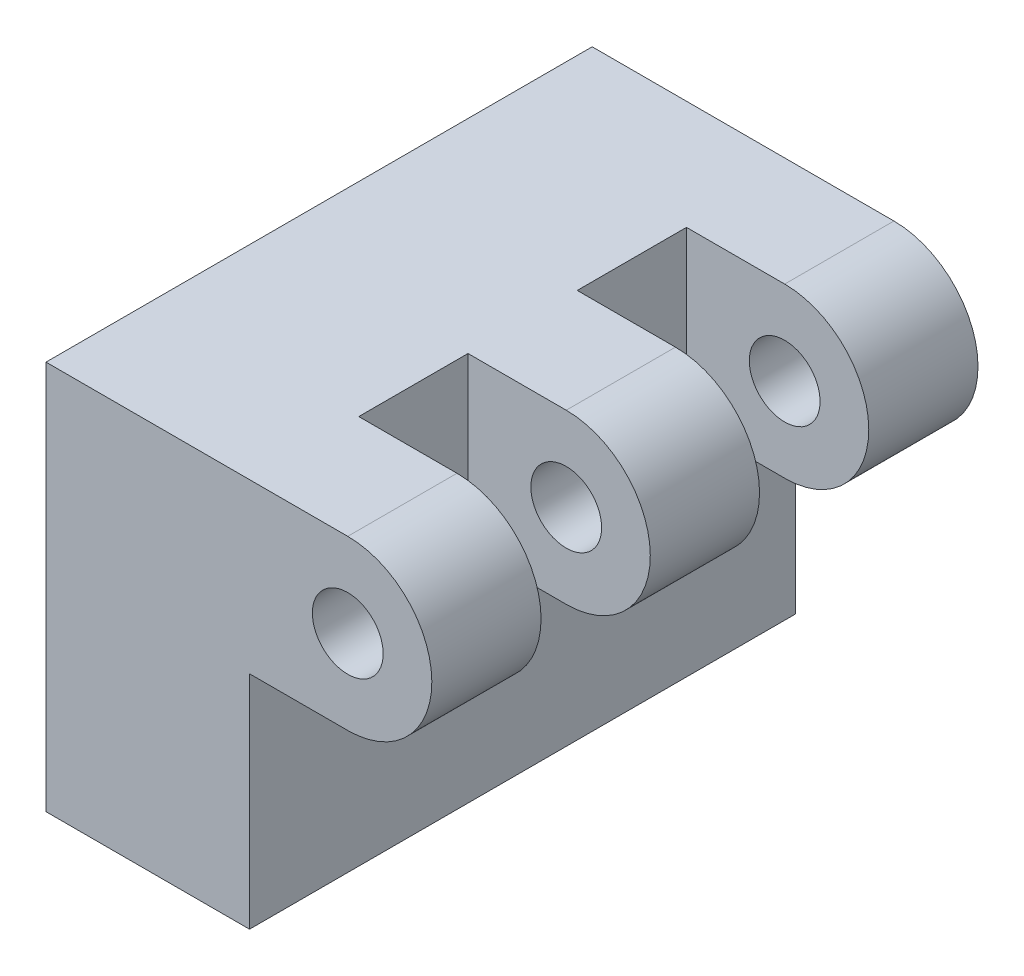
from build123d import *

# Parameters (mm, degrees)
SKETCH1_W           = 5.75
SKETCH1_H           = 15.43
BOSS_EXTRUDE3_DEPTH = 11
SKETCH3_R           = 1
BOSS_EXTRUDE4_DEPTH = 3.086
SKETCH4_R           = 1
BOSS_EXTRUDE5_DEPTH = 1.543
BOSS_EXTRUDE6_START = -3.086
SKETCH5_R           = 1
BOSS_EXTRUDE6_DEPTH = 3.086


with BuildPart() as part:
    # Sketch1 → Boss-Extrude3 (new body)
    with BuildSketch(Plane(origin=(0, 0, 0), x_dir=(1, 0, 0), z_dir=(0, 1, 0))):
        with Locations((21.975, 0)):
            Rectangle(SKETCH1_W, SKETCH1_H)
    extrude(amount=BOSS_EXTRUDE3_DEPTH)

    # Sketch3 → Boss-Extrude4 (add)
    with BuildSketch(Plane(origin=(0, 0, -7.715), x_dir=(-1, 0, 0), z_dir=(0, 0, -1))):
        with BuildLine():
            Line((-24.85, 11), (-24.85, 6.250173181))
            Line((-24.85, 6.250173181), (-27.653680617, 6.250173181))
            ThreePointArc((-27.653680617, 6.250173181), (-29.999956704, 8.63934057), (-27.625, 11))
            Line((-27.625, 11), (-24.85, 11))
        make_face()
        with Locations((-27.625, 8.625)):
            Circle(SKETCH3_R, mode=Mode.SUBTRACT)
    extrude(amount=-BOSS_EXTRUDE4_DEPTH)

    # Sketch4 → Boss-Extrude5 (add, symmetric)
    with BuildSketch(Plane.XY):
        with BuildLine():
            Line((27.625, 11), (24.85, 11))
            Line((24.85, 11), (24.85, 6.250173181))
            Line((24.85, 6.250173181), (27.653680617, 6.250173181))
            ThreePointArc((27.653680617, 6.250173181), (29.999956704, 8.63934057), (27.625, 11))
        make_face()
        with Locations(Location((27.625, 8.625, 0), (0, 0, 180))):
            Circle(SKETCH4_R, mode=Mode.SUBTRACT)
    extrude(amount=BOSS_EXTRUDE5_DEPTH, both=True)

    # Sketch5 → Boss-Extrude6 (add)
    with BuildSketch(Plane.XY.offset(7.715).offset(BOSS_EXTRUDE6_START)):
        with BuildLine():
            Line((24.85, 6.250173181), (27.653680617, 6.250173181))
            ThreePointArc((27.653680617, 6.250173181), (29.999956704, 8.63934057), (27.625, 11))
            Line((27.625, 11), (24.85, 11))
            Line((24.85, 11), (24.85, 6.250173181))
        make_face()
        with Locations(Location((27.625, 8.625, 0), (0, 0, 180))):
            Circle(SKETCH5_R, mode=Mode.SUBTRACT)
    extrude(amount=BOSS_EXTRUDE6_DEPTH)


solid = part.part
